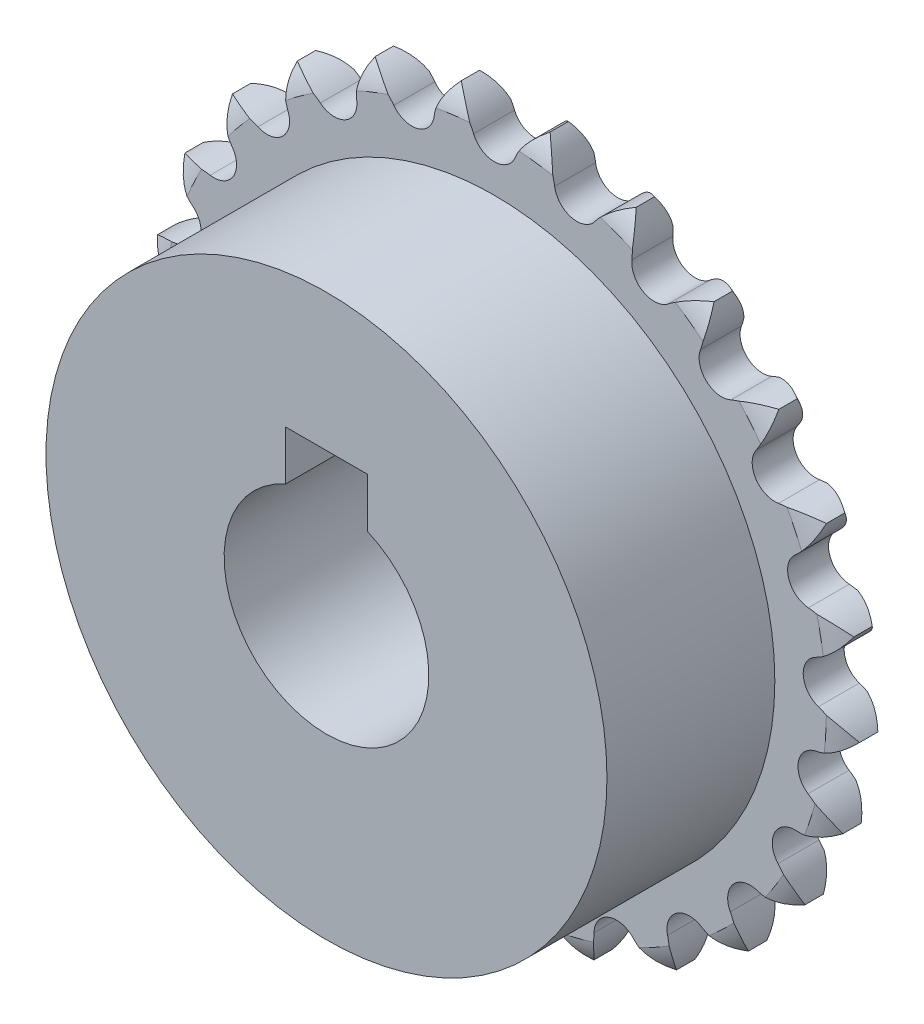
from build123d import *

# Parameters (mm, degrees)
CROQUIS1_R              = 7.5
SALIENTE_EXTRUIR1_DEPTH = 1.5
CROQUIS2_R              = 20.55
CROQUIS2_R_2            = 7.5
SALIENTE_EXTRUIR2_DEPTH = 12.3
CROQUIS3_W              = 6
CROQUIS3_H              = 6
CORTAR_EXTRUIR1_DEPTH   = 40.761475922


with BuildPart() as part:
    # Croquis1 → Saliente-Extruir1 (new, symmetric)
    with BuildSketch(Plane.XY):
        with BuildLine():
            ThreePointArc((1.523144543, 23.690546929), (0, 22.675), (-1.523144543, 23.690546929))
            ThreePointArc((-1.523144543, 23.690546929), (-2.232382747, 24.861797563), (-3.255704575, 25.771555396))
            ThreePointArc((-3.255704575, 25.771555396), (-4.020629293, 24.635889488), (-4.416307286, 23.325055478))
            ThreePointArc((-4.416307286, 23.325055478), (-5.639043191, 21.962623179), (-7.366891599, 22.567474188))
            ThreePointArc((-7.366891599, 22.567474188), (-8.345125969, 23.525547461), (-9.562545832, 24.152233789))
            ThreePointArc((-9.562545832, 24.152233789), (-10.021010407, 22.862017873), (-10.078266286, 21.493965007))
            ThreePointArc((-10.078266286, 21.493965007), (-10.92376456, 19.87025397), (-12.747749762, 20.026404047))
            ThreePointArc((-12.747749762, 20.026404047), (-13.933514234, 20.711100692), (-15.268537166, 21.015338508))
            ThreePointArc((-15.268537166, 21.015338508), (-15.391734583, 19.651641593), (-15.106970751, 18.312329667))
            ThreePointArc((-15.106970751, 18.312329667), (-15.522105627, 16.529363627), (-17.327619925, 16.227001288))
            ThreePointArc((-17.327619925, 16.227001288), (-18.646408557, 16.595299296), (-20.015150157, 16.557972219))
            ThreePointArc((-20.015150157, 16.557972219), (-19.795339468, 15.206480399), (-19.186448683, 13.980063305))
            ThreePointArc((-19.186448683, 13.980063305), (-19.145135711, 12.149872576), (-20.818732001, 11.407996359))
            ThreePointArc((-20.818732001, 11.407996359), (-22.187680453, 11.436754212), (-23.504137652, 11.06020764))
            ThreePointArc((-23.504137652, 11.06020764), (-22.955130372, 9.805840116), (-22.060371482, 8.76937815))
            ThreePointArc((-22.060371482, 8.76937815), (-21.565206507, 7.006960347), (-23.00172658, 5.872185064))
            ThreePointArc((-23.00172658, 5.872185064), (-24.334818786, 5.559595799), (-25.516273737, 4.867489538))
            ThreePointArc((-25.516273737, 4.867489538), (-24.672566012, 3.789062835), (-23.548160009, 3.007680715))
            ThreePointArc((-23.548160009, 3.007680715), (-22.630256067, 1.42377503), (-23.739438083, -0.032597216))
            ThreePointArc((-23.739438083, -0.032597216), (-24.952910957, -0.666892464), (-25.9251285, -1.631070833))
            ThreePointArc((-25.9251285, -1.631070833), (-24.83973359, -2.465795199), (-23.556331038, -2.943000361))
            ThreePointArc((-23.556331038, -2.943000361), (-22.27336341, -4.248871308), (-22.985513384, -5.935331293))
            ThreePointArc((-22.985513384, -5.935331293), (-24.003119962, -6.851477421), (-24.705012094, -8.027145025))
            ThreePointArc((-24.705012094, -8.027145025), (-23.446129352, -8.565718252), (-22.084371153, -8.7087619))
            ThreePointArc((-22.084371153, -8.7087619), (-20.516953415, -9.654545436), (-20.787324344, -11.465126676))
            ThreePointArc((-20.787324344, -11.465126676), (-21.545124663, -12.605558854), (-21.932588919, -13.918844173))
            ThreePointArc((-21.932588919, -13.918844173), (-20.579318579, -14.127425725), (-19.224769009, -13.927319901))
            ThreePointArc((-19.224769009, -13.927319901), (-17.47138778, -14.453588968), (-17.282991265, -16.274525984))
            ThreePointArc((-17.282991265, -16.274525984), (-17.733369944, -17.567586664), (-17.78206052, -18.935971152))
            ThreePointArc((-17.78206052, -18.935971152), (-16.419433533, -18.801455083), (-15.157203924, -18.270773172))
            ThreePointArc((-15.157203924, -18.270773172), (-13.328030596, -18.344460347), (-12.692704283, -20.061336971))
            ThreePointArc((-12.692704283, -20.061336971), (-12.807362373, -21.425778395), (-12.514219861, -22.763281422))
            ThreePointArc((-12.514219861, -22.763281422), (-11.227855092, -22.294119871), (-10.137255972, -21.466206568))
            ThreePointArc((-10.137255972, -21.466206568), (-8.347224232, -21.082681818), (-7.30488801, -22.587620376))
            ThreePointArc((-7.30488801, -22.587620376), (-7.076621121, -23.937709671), (-6.460064743, -25.160291002))
            ThreePointArc((-6.460064743, -25.160291002), (-5.330789223, -24.385963115), (-4.480346945, -23.312839259))
            ThreePointArc((-4.480346945, -23.312839259), (-2.841931071, -22.496200852), (-1.458078758, -23.694640521))
            ThreePointArc((-1.458078758, -23.694640521), (-0.901229739, -24.945546612), (0, -25.976386966))
            ThreePointArc((0, -25.976386966), (0.901229739, -24.945546612), (1.458078758, -23.694640521))
            ThreePointArc((1.458078758, -23.694640521), (2.841931071, -22.496200852), (4.480346945, -23.312839259))
            ThreePointArc((4.480346945, -23.312839259), (5.330789223, -24.385963115), (6.460064743, -25.160291002))
            ThreePointArc((6.460064743, -25.160291002), (7.076621121, -23.937709671), (7.30488801, -22.587620376))
            ThreePointArc((7.30488801, -22.587620376), (8.347224232, -21.082681818), (10.137255972, -21.466206568))
            ThreePointArc((10.137255972, -21.466206568), (11.227855092, -22.294119871), (12.514219861, -22.763281422))
            ThreePointArc((12.514219861, -22.763281422), (12.807362373, -21.425778395), (12.692704283, -20.061336971))
            ThreePointArc((12.692704283, -20.061336971), (13.328030596, -18.344460347), (15.157203924, -18.270773172))
            ThreePointArc((15.157203924, -18.270773172), (16.419433533, -18.801455083), (17.78206052, -18.935971152))
            ThreePointArc((17.78206052, -18.935971152), (17.733369944, -17.567586664), (17.282991265, -16.274525984))
            ThreePointArc((17.282991265, -16.274525984), (17.47138778, -14.453588968), (19.224769009, -13.927319901))
            ThreePointArc((19.224769009, -13.927319901), (20.579318579, -14.127425725), (21.932588919, -13.918844173))
            ThreePointArc((21.932588919, -13.918844173), (21.545124663, -12.605558854), (20.787324344, -11.465126676))
            ThreePointArc((20.787324344, -11.465126676), (20.516953415, -9.654545436), (22.084371153, -8.7087619))
            ThreePointArc((22.084371153, -8.7087619), (23.446129352, -8.565718252), (24.705012094, -8.027145025))
            ThreePointArc((24.705012094, -8.027145025), (24.003119963, -6.851477421), (22.985513384, -5.935331293))
            ThreePointArc((22.985513384, -5.935331293), (22.27336341, -4.248871308), (23.556331038, -2.943000361))
            ThreePointArc((23.556331038, -2.943000361), (24.83973359, -2.465795199), (25.9251285, -1.631070833))
            ThreePointArc((25.9251285, -1.631070833), (24.952910957, -0.666892464), (23.739438083, -0.032597216))
            ThreePointArc((23.739438083, -0.032597216), (22.630256067, 1.42377503), (23.548160009, 3.007680715))
            ThreePointArc((23.548160009, 3.007680715), (24.672566012, 3.789062835), (25.516273737, 4.867489538))
            ThreePointArc((25.516273737, 4.867489538), (24.334818786, 5.559595799), (23.00172658, 5.872185064))
            ThreePointArc((23.00172658, 5.872185064), (21.565206507, 7.006960347), (22.060371482, 8.76937815))
            ThreePointArc((22.060371482, 8.76937815), (22.955130372, 9.805840116), (23.504137652, 11.06020764))
            ThreePointArc((23.504137652, 11.06020764), (22.187680453, 11.436754212), (20.818732001, 11.407996359))
            ThreePointArc((20.818732001, 11.407996359), (19.145135711, 12.149872576), (19.186448683, 13.980063305))
            ThreePointArc((19.186448683, 13.980063305), (19.795339468, 15.206480399), (20.015150157, 16.557972219))
            ThreePointArc((20.015150157, 16.557972219), (18.646408557, 16.595299296), (17.327619925, 16.227001288))
            ThreePointArc((17.327619925, 16.227001288), (15.522105627, 16.529363627), (15.106970751, 18.312329667))
            ThreePointArc((15.106970751, 18.312329667), (15.391734583, 19.651641593), (15.268537166, 21.015338508))
            ThreePointArc((15.268537166, 21.015338508), (13.933514234, 20.711100692), (12.747749762, 20.026404047))
            ThreePointArc((12.747749762, 20.026404047), (11.291281072, 19.722469666), (10.182314609, 20.714372149))
            ThreePointArc((10.182314609, 20.714372149), (10.0831603, 21.097878356), (10.078266286, 21.493965007))
            ThreePointArc((10.078266286, 21.493965007), (10.021010407, 22.862017873), (9.562545832, 24.152233789))
            ThreePointArc((9.562545832, 24.152233789), (8.345125969, 23.525547461), (7.366891599, 22.567474188))
            ThreePointArc((7.366891599, 22.567474188), (5.639043191, 21.962623179), (4.416307286, 23.325055478))
            ThreePointArc((4.416307286, 23.325055478), (4.020629293, 24.635889488), (3.255704575, 25.771555396))
            ThreePointArc((3.255704575, 25.771555396), (2.232382747, 24.861797563), (1.523144543, 23.690546929))
        make_face()
        Circle(CROQUIS1_R, mode=Mode.SUBTRACT)
    extrude(amount=SALIENTE_EXTRUIR1_DEPTH, both=True)

    # Croquis2 → Saliente-Extruir2 (add)
    with BuildSketch(Plane.XY.offset(1.5)):
        Circle(CROQUIS2_R)
        Circle(CROQUIS2_R_2, mode=Mode.SUBTRACT)
    extrude(amount=SALIENTE_EXTRUIR2_DEPTH)

    # Croquis3 → Cortar-Extruir1 (cut, through all)
    with BuildSketch(Plane.XY.offset(13.8)):
        with Locations((0, 7.5)):
            Rectangle(CROQUIS3_W, CROQUIS3_H)
    extrude(amount=-CORTAR_EXTRUIR1_DEPTH, mode=Mode.SUBTRACT)

    # Croquis4 → Cortar-Revolución1 (revolve, cut)
    with BuildSketch(Plane(origin=(0, 0, 0), x_dir=(0, 0, -1), z_dir=(1, 0, 0))):
        with BuildLine():
            Line((-3.02586584, 27.218110792), (-3.02586584, 24.325))
            Line((-3.02586584, 24.325), (-1.5, 24.325))
            add(Edge.make_bspline(
                [(-1.5, 24.325), (-1.226187836, 25.488631586), (-0.3800085, 26.275016771)],
                knots=[0, 0, 0, 1, 1, 1], degree=2))
            Line((-0.3800085, 26.275016771), (0.3800085, 26.275016771))
            add(Edge.make_bspline(
                [(1.5, 24.325), (1.226187836, 25.488631586), (0.3800085, 26.275016771)],
                knots=[0, 0, 0, 1, 1, 1], degree=2))
            Line((1.5, 24.325), (3.02586584, 24.325))
            Line((3.02586584, 24.325), (3.02586584, 27.218110792))
            Line((3.02586584, 27.218110792), (-3.02586584, 27.218110792))
        make_face()
    revolve(axis=Axis((0, 0, 79.47594022), (0, 0, -1)), mode=Mode.SUBTRACT)


solid = part.part
